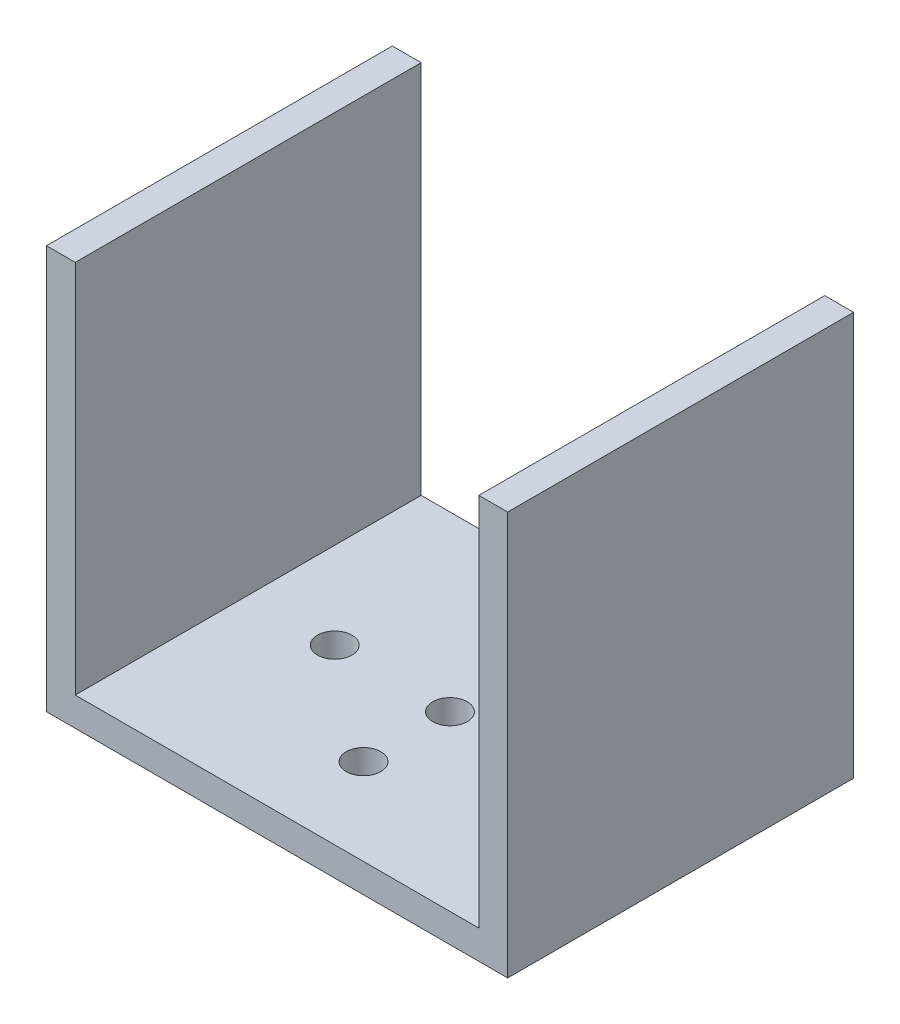
from build123d import *

# Parameters (mm, degrees)
BOSS_EXTRUDE1_DEPTH = 60
SKETCH2_R           = 3
CUT_EXTRUDE1_DEPTH  = 120.268604419


with BuildPart() as part:
    # Sketch1 → Boss-Extrude1 (new body)
    with BuildSketch(Plane.XY):
        Polygon((0, 70), (0, 0), (80, 0), (80, 70), (75, 70), (75, 5), (5, 5), (5, 70), align=None)
    extrude(amount=-BOSS_EXTRUDE1_DEPTH)

    # Sketch2 → Cut-Extrude1 (cut, through all)
    with BuildSketch(Plane(origin=(0, 5, 0), x_dir=(1, 0, 0), z_dir=(0, 1, 0))):
        with Locations(Location((40, 30, 0), (0, 0, 180))):
            Circle(SKETCH2_R)
        with Locations(Location((20, 30, 0), (0, 0, 180))):
            Circle(SKETCH2_R)
        with Locations(Location((40, 45, 0), (0, 0, 180))):
            Circle(SKETCH2_R)
        with Locations((40, 15)):
            Circle(SKETCH2_R)
        with Locations((60, 30)):
            Circle(SKETCH2_R)
    extrude(amount=-CUT_EXTRUDE1_DEPTH, mode=Mode.SUBTRACT)


solid = part.part
